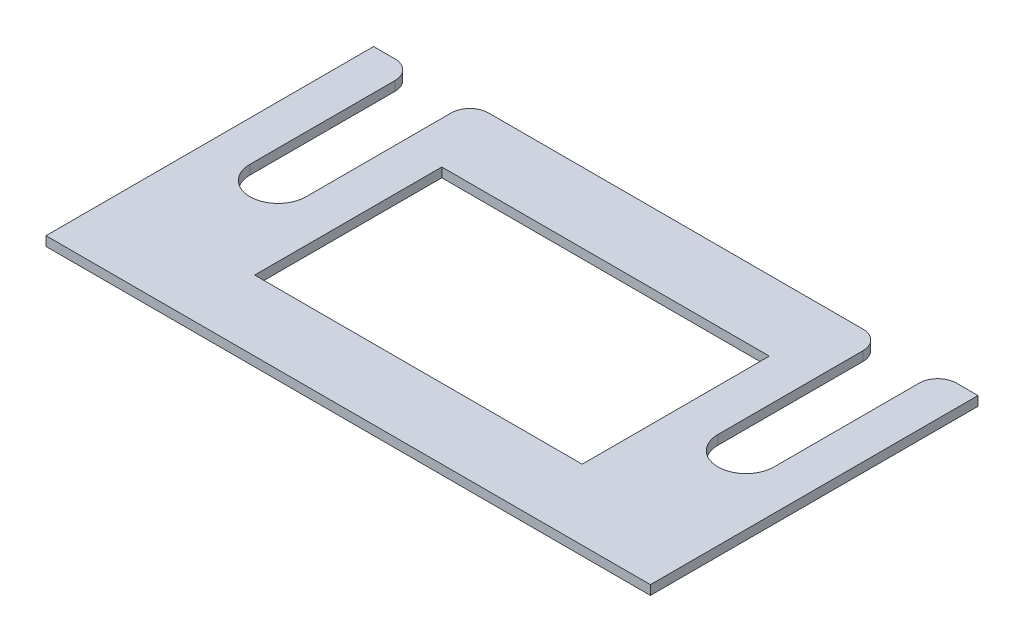
from build123d import *

# Parameters (mm, degrees)
SKETCH1_W               = 64.58
SKETCH1_H               = 35
SKETCH1_R               = 3
BOSS_EXTRUDE1_DEPTH     = 1
CUT_EXTRUDE1_DEPTH      = 37.740904997
CUT_EXTRUDE1_DEPTH_BACK = 37.740904997
SKETCH2_W               = 6
SKETCH2_H               = 17.5
FILLET1_R               = 2
CUT_EXTRUDE2_DEPTH      = 37.740904997
CUT_EXTRUDE2_DEPTH_BACK = 37.740904997
SKETCH3_W               = 35
SKETCH3_H               = 20


with BuildPart() as part:
    # Sketch1 → Boss-Extrude1 (new body)
    with BuildSketch(Plane(origin=(0, 0, 0), x_dir=(1, 0, 0), z_dir=(0, 1, 0))):
        Rectangle(SKETCH1_W, SKETCH1_H)
        with Locations(Location((-25, 0, 0), (0, 0, 270))):
            Circle(SKETCH1_R, mode=Mode.SUBTRACT)
        with Locations(Location((25, 0, 0), (0, 0, 270))):
            Circle(SKETCH1_R, mode=Mode.SUBTRACT)
    extrude(amount=BOSS_EXTRUDE1_DEPTH)

    # Sketch2 → Cut-Extrude1 (cut, two sides: drawn at the far end of the back side and taken through both)
    with BuildSketch(Plane(origin=(0, 1, 0), x_dir=(1, 0, 0), z_dir=(0, 1, 0)).offset(-CUT_EXTRUDE1_DEPTH_BACK)):
        with Locations((-25, 8.75)):
            Rectangle(SKETCH2_W, SKETCH2_H)
        with Locations((25, 8.75)):
            Rectangle(SKETCH2_W, SKETCH2_H)
    extrude(amount=CUT_EXTRUDE1_DEPTH + CUT_EXTRUDE1_DEPTH_BACK, mode=Mode.SUBTRACT)

    # Fillet1
    fillet1_edges = [part.edges().sort_by_distance(p)[0] for p in [
        (22, 0.5, -17.5),
        (-28, 0.5, -17.5),
        (-22, 0.5, -17.5),
        (28, 0.5, -17.5),
    ]]
    fillet(fillet1_edges, radius=FILLET1_R)

    # Sketch3 → Cut-Extrude2 (cut, two sides: drawn at the far end of the back side and taken through both)
    with BuildSketch(Plane.XZ.offset(-CUT_EXTRUDE2_DEPTH_BACK)):
        Rectangle(SKETCH3_W, SKETCH3_H)
    extrude(amount=CUT_EXTRUDE2_DEPTH + CUT_EXTRUDE2_DEPTH_BACK, mode=Mode.SUBTRACT)


solid = part.part
